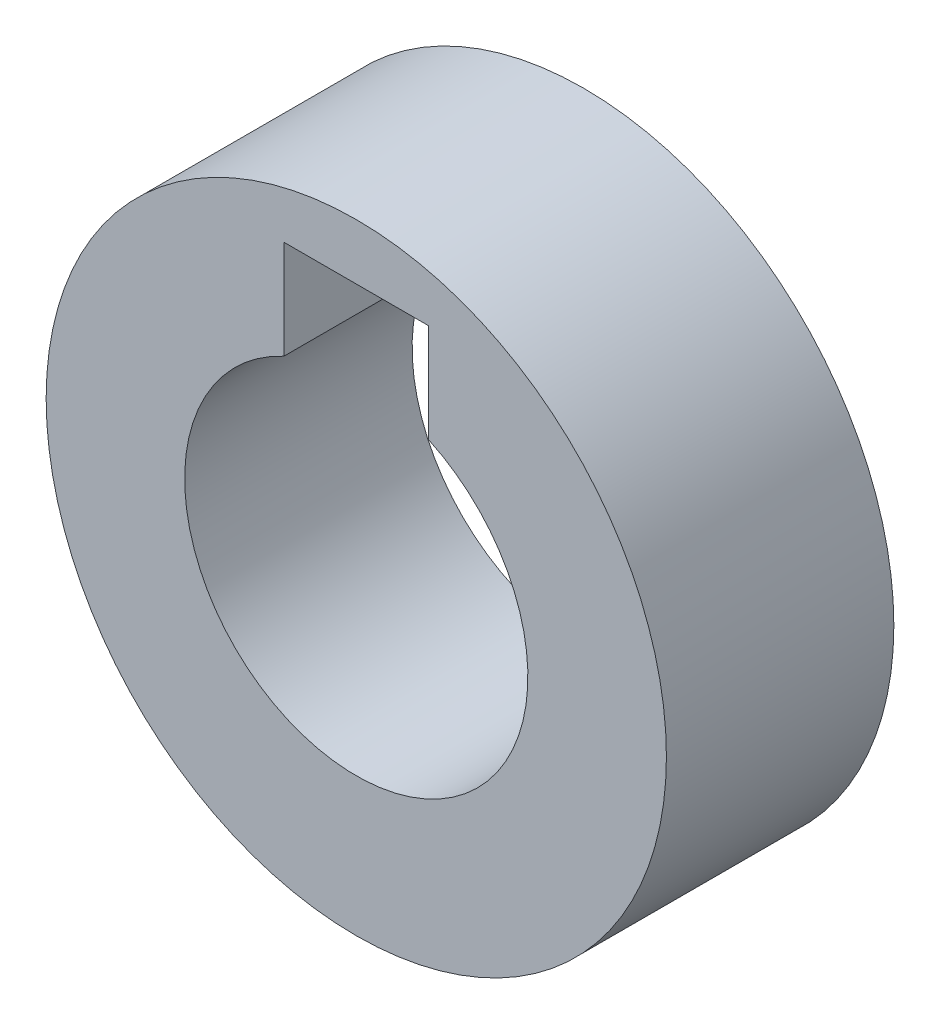
from build123d import *

# Parameters (mm, degrees)
SKIZZE1_R                       = 7.5
AUFSATZ_LINEAR_AUSTRAGEN1_DEPTH = 5.5


with BuildPart() as part:
    # Skizze1 → Aufsatz-Linear austragen1 (new body)
    with BuildSketch(Plane.XY):
        Circle(SKIZZE1_R)
        with BuildLine():
            ThreePointArc((4.15, 0), (-2.23159136, -3.498928407), (-1.75, 3.762977544))
            Line((-1.75, 3.762977544), (-1.75, 6.15))
            Line((-1.75, 6.15), (1.75, 6.15))
            Line((1.75, 6.15), (1.75, 3.762977544))
            ThreePointArc((1.75, 3.762977544), (3.498928407, 2.23159136), (4.15, 0))
        make_face(mode=Mode.SUBTRACT)
    extrude(amount=AUFSATZ_LINEAR_AUSTRAGEN1_DEPTH)


solid = part.part
